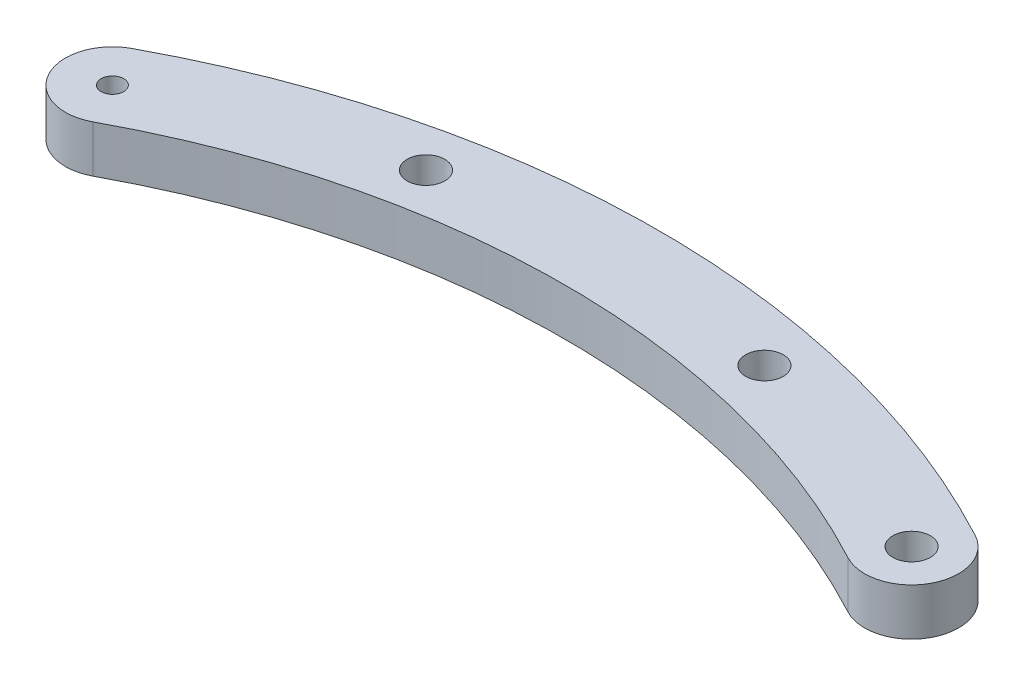
from build123d import *

# Parameters (mm, degrees)
SKETCH1_R           = 2.5
SKETCH1_R_2         = 0.6
SKETCH1_R_3         = 1
BOSS_EXTRUDE1_DEPTH = 2.5
SKETCH2_R           = 1
CUT_EXTRUDE1_DEPTH  = 46.745081512


with BuildPart() as part:
    # Sketch1 → Boss-Extrude1 (new body)
    # profile 1 of 3: a face of its own
    with BuildSketch(Plane(origin=(0, 0, 0), x_dir=(1, 0, 0), z_dir=(0, 1, 0))):
        Circle(SKETCH1_R)
        with Locations(Location((0, 0, 0), (0, 0, 270))):
            Circle(SKETCH1_R_2, mode=Mode.SUBTRACT)
    # profile 2 of 3: a face of its own
    with BuildSketch(Plane(origin=(0, 0, 0), x_dir=(1, 0, 0), z_dir=(0, 1, 0))):
        with BuildLine():
            ThreePointArc((-1.180555556, 2.203698841), (1.284252917, 2.144922946), (2.5, 0))
            ThreePointArc((2.5, 0), (2.144922946, -1.284252917), (1.180555556, -2.203698841))
            ThreePointArc((1.180555556, -2.203698841), (21.25, 2.833420868), (41.319444444, -2.203698841))
            ThreePointArc((41.319444444, -2.203698841), (40.296301159, 1.180555556), (43.680555556, 2.203698841))
            ThreePointArc((43.680555556, 2.203698841), (21.25, 7.833420868), (-1.180555556, 2.203698841))
        make_face()
    # profile 3 of 3: a face of its own
    with BuildSketch(Plane(origin=(0, 0, 0), x_dir=(1, 0, 0), z_dir=(0, 1, 0))):
        with Locations((42.5, 0)):
            Circle(SKETCH1_R)
        with Locations(Location((42.5, 0, 0), (0, 0, 270))):
            Circle(SKETCH1_R_3, mode=Mode.SUBTRACT)
    extrude(amount=BOSS_EXTRUDE1_DEPTH)

    # Sketch2 → Cut-Extrude1 (cut, through all)
    with BuildSketch(Plane(origin=(0, 2.5, 0), x_dir=(1, 0, 0), z_dir=(0, 1, 0))):
        with Locations(Location((12.25, 4.424236239, 0), (0, 0, 270))):
            Circle(SKETCH2_R)
        with Locations(Location((30.25, 4.424236239, 0), (0, 0, 270))):
            Circle(SKETCH2_R)
    extrude(amount=-CUT_EXTRUDE1_DEPTH, mode=Mode.SUBTRACT)


solid = part.part
